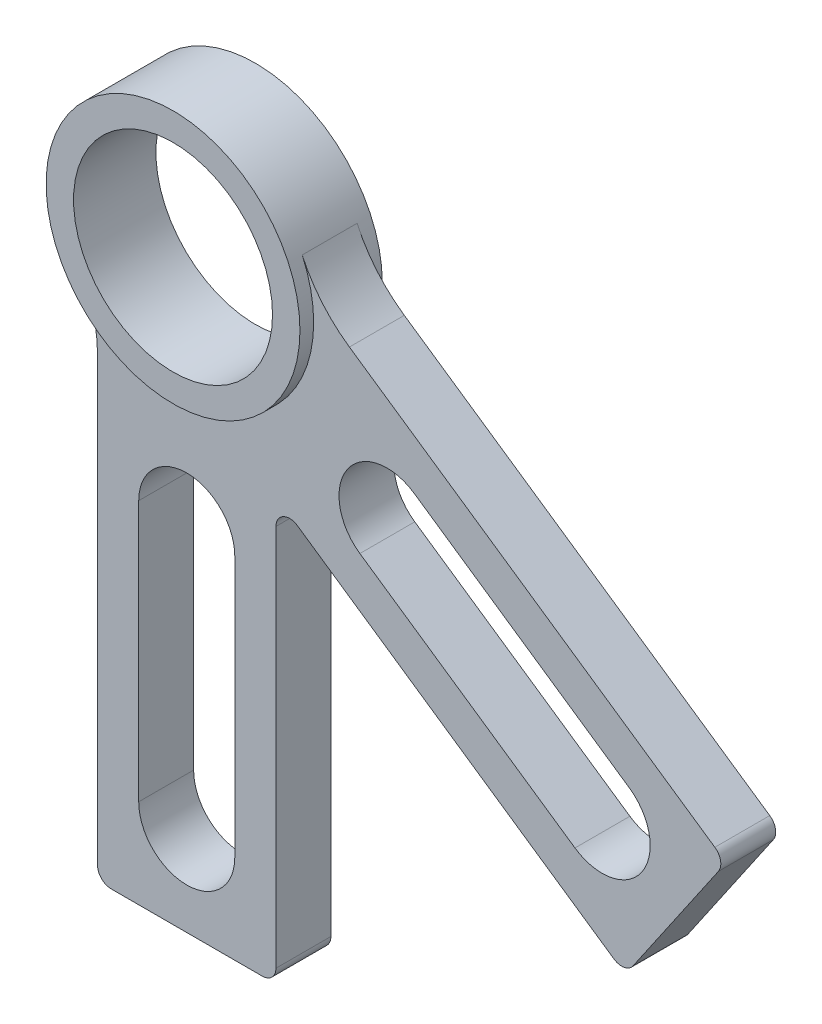
from build123d import *
from build123d.topology import SkipClean

# Parameters (mm, degrees)
BOSS_EXTRUDE1_DEPTH      = 4.7625
BOSS_EXTRUDE1_DEPTH_BACK = 4.7625
SKETCH1_R                = 11.5062
CUT_EXTRUDE1_START       = 3.175
CUT_EXTRUDE1_DEPTH       = 1.5875
CUT_EXTRUDE2_START       = -4.7625
CUT_EXTRUDE2_DEPTH       = 1.5875
FILLET1_R                = 1.5875


with BuildPart() as part:
    # Sketch1 → Boss-Extrude1 (new, two sides: drawn at the far end of the back side and taken through both)
    # profile 1 of 2: a face of its own
    with BuildSketch(Plane.XY.offset(-BOSS_EXTRUDE1_DEPTH_BACK)):
        with BuildLine():
            ThreePointArc((-12.585193267, -7.559797873), (-10.89585042, -11.492870345), (-10.31875, -15.734319794))
            Line((-10.31875, -15.734319794), (-10.31875, -68.439319794))
            Line((-10.31875, -68.439319794), (10.31875, -68.439319794))
            Line((10.31875, -68.439319794), (10.31875, -22.596549828))
            ThreePointArc((10.31875, -22.596549828), (11.166228871, -21.192083745), (12.80382084, -21.287151937))
            Line((12.80382084, -21.287151937), (50.720494758, -47.278411809))
            Line((50.720494758, -47.278411809), (62.388915679, -30.256239225))
            Line((62.388915679, -30.256239225), (18.812153865, -0.385081668))
            ThreePointArc((18.812153865, -0.385081668), (15.640023815, 2.489031981), (13.351109218, 6.106186705))
            ThreePointArc((13.351109218, 6.106186705), (6.843715397, -12.988502339), (-12.585193267, -7.559797873))
        make_face()
        with BuildLine():
            ThreePointArc((5.55625, -58.120569794), (0, -63.676819794), (-5.55625, -58.120569794))
            Line((-5.55625, -58.120569794), (-5.55625, -27.958069794))
            ThreePointArc((-5.55625, -27.958069794), (0, -22.401819794), (5.55625, -27.958069794))
            Line((5.55625, -27.958069794), (5.55625, -58.120569794))
        make_face(mode=Mode.SUBTRACT)
        with BuildLine():
            ThreePointArc((51.185116867, -28.350222438), (52.626511545, -36.074612997), (44.902120986, -37.516007675))
            Line((44.902120986, -37.516007675), (20.023561057, -20.462161714))
            ThreePointArc((20.023561057, -20.462161714), (18.582166378, -12.737771155), (26.306556937, -11.296376477))
            Line((26.306556937, -11.296376477), (51.185116867, -28.350222438))
        make_face(mode=Mode.SUBTRACT)
    # profile 2 of 2: a face of its own
    with BuildSketch(Plane.XY.offset(-BOSS_EXTRUDE1_DEPTH_BACK)):
        with BuildLine():
            ThreePointArc((13.351109218, 6.106186705), (-6.843715397, 12.988502339), (-12.585193267, -7.559797873))
            ThreePointArc((-12.585193267, -7.559797873), (6.843715397, -12.988502339), (13.351109218, 6.106186705))
        make_face()
        Circle(SKETCH1_R, mode=Mode.SUBTRACT)
    extrude(amount=BOSS_EXTRUDE1_DEPTH + BOSS_EXTRUDE1_DEPTH_BACK)

    # Sketch1<8> → Cut-Extrude1 (cut)
    with SkipClean():  # the faces are left unmerged after this step: merging them gives an invalid solid
        with BuildSketch(Plane.XY.offset(CUT_EXTRUDE1_START)):
            with BuildLine():
                ThreePointArc((-12.585193267, -7.559797873), (-10.89585042, -11.492870345), (-10.31875, -15.734319794))
                Line((-10.31875, -15.734319794), (-10.31875, -68.439319794))
                Line((-10.31875, -68.439319794), (10.31875, -68.439319794))
                Line((10.31875, -68.439319794), (10.31875, -22.596549828))
                ThreePointArc((10.31875, -22.596549828), (11.166228871, -21.192083745), (12.80382084, -21.287151937))
                Line((12.80382084, -21.287151937), (50.720494758, -47.278411809))
                Line((50.720494758, -47.278411809), (62.388915679, -30.256239225))
                Line((62.388915679, -30.256239225), (18.812153865, -0.385081668))
                ThreePointArc((18.812153865, -0.385081668), (15.640023815, 2.489031981), (13.351109218, 6.106186705))
                ThreePointArc((13.351109218, 6.106186705), (6.843715397, -12.988502339), (-12.585193267, -7.559797873))
            make_face()
            with BuildLine():
                ThreePointArc((5.55625, -58.120569794), (0, -63.676819794), (-5.55625, -58.120569794))
                Line((-5.55625, -58.120569794), (-5.55625, -27.958069794))
                ThreePointArc((-5.55625, -27.958069794), (0, -22.401819794), (5.55625, -27.958069794))
                Line((5.55625, -27.958069794), (5.55625, -58.120569794))
            make_face(mode=Mode.SUBTRACT)
            with BuildLine():
                ThreePointArc((51.185116867, -28.350222438), (52.626511545, -36.074612997), (44.902120986, -37.516007675))
                Line((44.902120986, -37.516007675), (20.023561057, -20.462161714))
                ThreePointArc((20.023561057, -20.462161714), (18.582166378, -12.737771155), (26.306556937, -11.296376477))
                Line((26.306556937, -11.296376477), (51.185116867, -28.350222438))
            make_face(mode=Mode.SUBTRACT)
        extrude(amount=CUT_EXTRUDE1_DEPTH, mode=Mode.SUBTRACT)

    # Sketch1<9> → Cut-Extrude2 (cut)
    with SkipClean():  # the faces are left unmerged after this step: merging them gives an invalid solid
        with BuildSketch(Plane.XY.offset(CUT_EXTRUDE2_START)):
            with BuildLine():
                ThreePointArc((-12.585193267, -7.559797873), (6.843715397, -12.988502339), (13.351109218, 6.106186705))
                ThreePointArc((13.351109218, 6.106186705), (15.640023815, 2.489031981), (18.812153865, -0.385081668))
                Line((18.812153865, -0.385081668), (62.388915679, -30.256239225))
                Line((62.388915679, -30.256239225), (50.720494758, -47.278411809))
                Line((50.720494758, -47.278411809), (12.80382084, -21.287151937))
                ThreePointArc((12.80382084, -21.287151937), (11.166228871, -21.192083745), (10.31875, -22.596549828))
                Line((10.31875, -22.596549828), (10.31875, -68.439319794))
                Line((10.31875, -68.439319794), (-10.31875, -68.439319794))
                Line((-10.31875, -68.439319794), (-10.31875, -15.734319794))
                ThreePointArc((-10.31875, -15.734319794), (-10.89585042, -11.492870345), (-12.585193267, -7.559797873))
            make_face()
            with BuildLine():
                ThreePointArc((26.306556937, -11.296376477), (18.582166378, -12.737771155), (20.023561057, -20.462161714))
                Line((20.023561057, -20.462161714), (44.902120986, -37.516007675))
                ThreePointArc((44.902120986, -37.516007675), (52.626511545, -36.074612997), (51.185116867, -28.350222438))
                Line((51.185116867, -28.350222438), (26.306556937, -11.296376477))
            make_face(mode=Mode.SUBTRACT)
            with BuildLine():
                ThreePointArc((5.55625, -27.958069794), (0, -22.401819794), (-5.55625, -27.958069794))
                Line((-5.55625, -27.958069794), (-5.55625, -58.120569794))
                ThreePointArc((-5.55625, -58.120569794), (0, -63.676819794), (5.55625, -58.120569794))
                Line((5.55625, -58.120569794), (5.55625, -27.958069794))
            make_face(mode=Mode.SUBTRACT)
        extrude(amount=CUT_EXTRUDE2_DEPTH, mode=Mode.SUBTRACT)

    # Fillet1
    fillet1_edges = [part.edges().sort_by_distance(p)[0] for p in [
        (-10.31875, -68.439319794, 0),
        (10.31875, -68.439319794, 0),
        (50.720494758, -47.278411809, 0),
        (62.388915679, -30.256239225, 0),
    ]]
    fillet(fillet1_edges, radius=FILLET1_R)


solid = part.part
